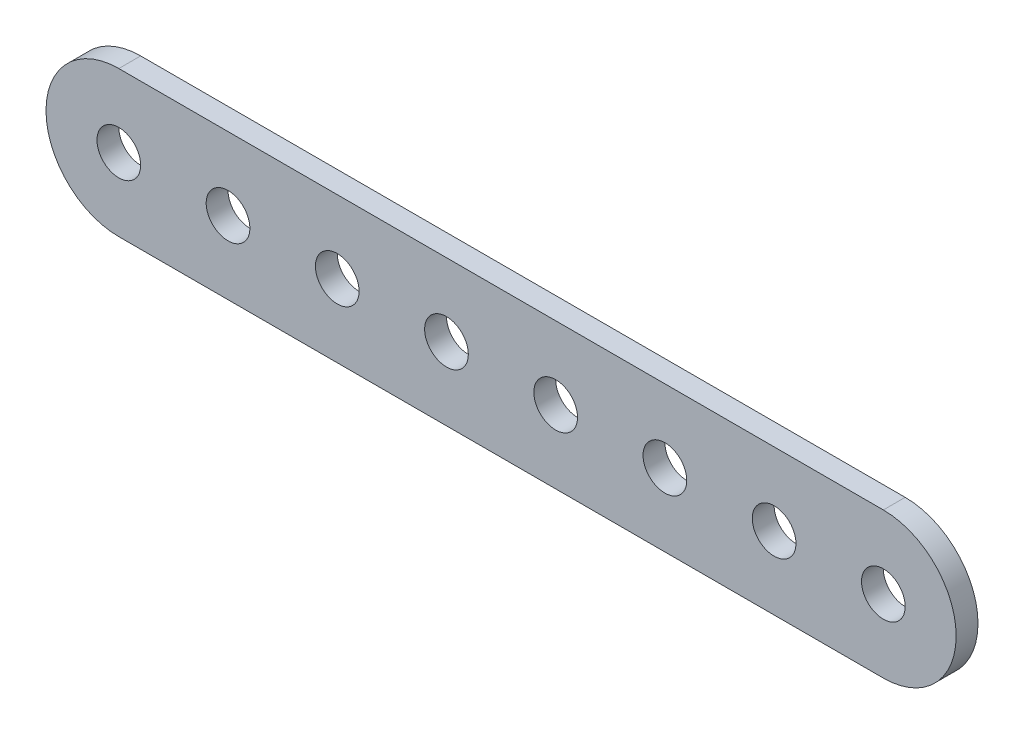
from build123d import *

# Parameters (mm, degrees)
SKETCH3_R           = 3
BOSS_EXTRUDE1_DEPTH = 3


with BuildPart() as part:
    # Sketch3 → Boss-Extrude1 (new body)
    with BuildSketch(Plane.XY):
        with BuildLine():
            Line((-52.5, 10), (52.5, 10))
            ThreePointArc((52.5, 10), (62.5, 0), (52.5, -10))
            Line((52.5, -10), (-52.5, -10))
            ThreePointArc((-52.5, -10), (-62.5, 0), (-52.5, 10))
        make_face()
        with Locations((52.5, 0)):
            Circle(SKETCH3_R, mode=Mode.SUBTRACT)
        with Locations((-52.5, 0)):
            Circle(SKETCH3_R, mode=Mode.SUBTRACT)
        with Locations((-37.5, 0)):
            Circle(SKETCH3_R, mode=Mode.SUBTRACT)
        with Locations((-22.5, 0)):
            Circle(SKETCH3_R, mode=Mode.SUBTRACT)
        with Locations((-7.5, 0)):
            Circle(SKETCH3_R, mode=Mode.SUBTRACT)
        with Locations(Location((7.5, 0, 0), (0, 0, 180))):
            Circle(SKETCH3_R, mode=Mode.SUBTRACT)
        with Locations(Location((22.5, 0, 0), (0, 0, 180))):
            Circle(SKETCH3_R, mode=Mode.SUBTRACT)
        with Locations(Location((37.5, 0, 0), (0, 0, 180))):
            Circle(SKETCH3_R, mode=Mode.SUBTRACT)
    extrude(amount=BOSS_EXTRUDE1_DEPTH)


solid = part.part
